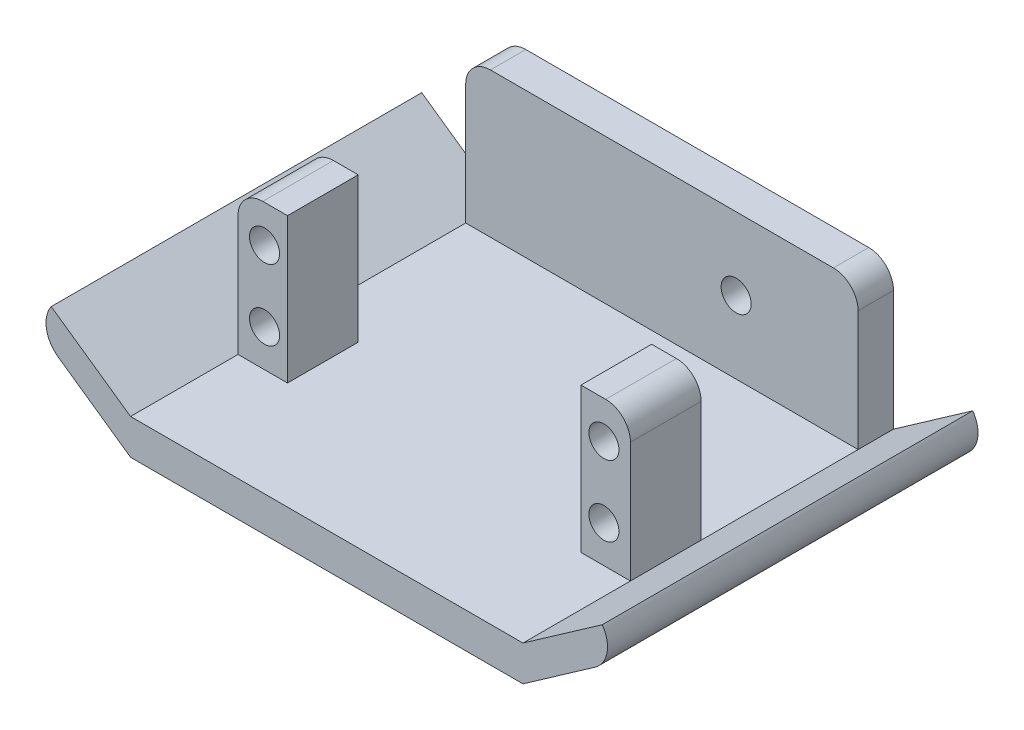
from build123d import *

# Parameters (mm, degrees)
SKETCH1_W           = 55.5
SKETCH1_H           = 40.4
BASE_DEPTH          = 5
SKETCH2_W           = 55.5
SKETCH2_H           = 25.5
WALL_DEPTH          = 5
SKETCH3_W           = 7
SKETCH3_H           = 20.5
MOUNTINGTABS_DEPTH  = 5
LIPS_REACH          = 75.23
SKETCH5_R           = 2.125
MOUNTINGHOLES_DEPTH = 5
FILLETS_R           = 3.5
SKETCH6_R           = 2.125
THROUGHHOLE_DEPTH   = 5
SKETCH7_R           = 2.125
BOSS_EXTRUDE1_DEPTH = 5
BOSS_EXTRUDE2_START = 12
BOSS_EXTRUDE2_DEPTH = 12


with BuildPart() as part:
    # Sketch1 → base (new body)
    with BuildSketch(Plane(origin=(0, 0, 0), x_dir=(1, 0, 0), z_dir=(0, 1, 0))):
        with Locations((27.75, 20.2)):
            Rectangle(SKETCH1_W, SKETCH1_H)
    extrude(amount=BASE_DEPTH)

    # Sketch2 → wall (add)
    with BuildSketch(Plane(origin=(0, 0, -40.4), x_dir=(-1, 0, 0), z_dir=(0, 0, -1))):
        with Locations((-27.75, 12.75)):
            Rectangle(SKETCH2_W, SKETCH2_H)
    extrude(amount=-WALL_DEPTH)

    # Sketch3 → mountingTabs (add)
    with BuildSketch(Plane.XY.offset(-8.2)):
        with Locations((3.5, 15.25)):
            Rectangle(SKETCH3_W, SKETCH3_H)
        with Locations((52, 15.25)):
            Rectangle(SKETCH3_W, SKETCH3_H)
    extrude(amount=MOUNTINGTABS_DEPTH)

    # lips: up to this face of the body (flat: up to its plane)
    lips_end = Plane(part.part.faces().sort_by_distance((27.75, 12.75, -40.4))[0])
    # Sketch4 → lips (add, up to the picked face)
    with BuildSketch(Plane.XY, mode=Mode.PRIVATE) as lips_sk1:
        with BuildLine():
            Line((0, 0), (-10.208884478, 7.148337868))
            ThreePointArc((-10.208884478, 7.148337868), (-11.894564223, 9.792816133), (-11.218174515, 12.85505036))
            Line((-11.218174515, 12.85505036), (0, 5))
            Line((0, 5), (0, 0))
        make_face()
    lips_tool1 = split(extrude(lips_sk1.sketch, amount=-LIPS_REACH, mode=Mode.PRIVATE), bisect_by=lips_end, keep=Keep.BOTH, mode=Mode.PRIVATE)
    # Sketch4 → lips (add, up to the picked face)
    with BuildSketch(Plane.XY, mode=Mode.PRIVATE) as lips_sk2:
        with BuildLine():
            Line((55.5, 5), (66.718174515, 12.85505036))
            ThreePointArc((66.718174515, 12.85505036), (67.394564223, 9.792816133), (65.708884478, 7.148337868))
            Line((65.708884478, 7.148337868), (55.5, 0))
            Line((55.5, 0), (55.5, 5))
        make_face()
    lips_tool2 = split(extrude(lips_sk2.sketch, amount=-LIPS_REACH, mode=Mode.PRIVATE), bisect_by=lips_end, keep=Keep.BOTH, mode=Mode.PRIVATE)
    add(lips_tool1.solids().sort_by(Axis((-5.839287, 6.590277, 0), (0, 0, -1)))[0])
    add(lips_tool2.solids().sort_by(Axis((61.339287, 6.590277, 0), (0, 0, -1)))[0])

    # Sketch5 → mountingHoles (cut)
    with BuildSketch(Plane.XY.offset(-3.2)):
        with Locations((3.75, 20.25)):
            Circle(SKETCH5_R)
        with Locations(Location((3.75, 10.25, 0), (0, 0, 180))):
            Circle(SKETCH5_R)
        with Locations((51.75, 10.25)):
            Circle(SKETCH5_R)
        with Locations(Location((51.75, 20.25, 0), (0, 0, 180))):
            Circle(SKETCH5_R)
    extrude(amount=-MOUNTINGHOLES_DEPTH, mode=Mode.SUBTRACT)

    # fillets
    fillets_edges = [part.edges().sort_by_distance(p)[0] for p in [
        (0, 25.5, -37.9),
        (55.5, 25.5, -37.9),
        (0, 25.5, -5.7),
        (55.5, 25.5, -5.7),
    ]]
    fillet(fillets_edges, radius=FILLETS_R)

    # Sketch6 → throughHole (cut)
    with BuildSketch(Plane.XY.offset(-35.4)):
        with Locations((38.25, 15.25)):
            Circle(SKETCH6_R)
    extrude(amount=-THROUGHHOLE_DEPTH, mode=Mode.SUBTRACT)

    # Sketch7 → Boss-Extrude1 (add)
    # profile 1 of 2: a face of its own
    with BuildSketch(Plane(origin=(0, 0, -8.2), x_dir=(-1, 0, 0), z_dir=(0, 0, -1))):
        with BuildLine():
            Line((-48.5, 25.5), (-52, 25.5))
            ThreePointArc((-52, 25.5), (-54.474873734, 24.474873734), (-55.5, 22))
            Line((-55.5, 22), (-55.5, 5))
            Line((-55.5, 5), (-48.5, 5))
            Line((-48.5, 5), (-48.5, 25.5))
        make_face()
        with Locations((-51.75, 20.25)):
            Circle(SKETCH7_R, mode=Mode.SUBTRACT)
        with Locations(Location((-51.75, 10.25, 0), (0, 0, 180))):
            Circle(SKETCH7_R, mode=Mode.SUBTRACT)
    # profile 2 of 2: a face of its own
    with BuildSketch(Plane(origin=(0, 0, -8.2), x_dir=(-1, 0, 0), z_dir=(0, 0, -1))):
        with BuildLine():
            Line((0, 5), (0, 22))
            ThreePointArc((0, 22), (-1.025126266, 24.474873734), (-3.5, 25.5))
            Line((-3.5, 25.5), (-7, 25.5))
            Line((-7, 25.5), (-7, 5))
            Line((-7, 5), (0, 5))
        make_face()
        with Locations((-3.75, 10.25)):
            Circle(SKETCH7_R, mode=Mode.SUBTRACT)
        with Locations(Location((-3.75, 20.25, 0), (0, 0, 180))):
            Circle(SKETCH7_R, mode=Mode.SUBTRACT)
    extrude(amount=BOSS_EXTRUDE1_DEPTH)

    # Sketch8 → Boss-Extrude2 (add)
    with BuildSketch(Plane.XY.offset(BOSS_EXTRUDE2_START)):
        with BuildLine():
            Line((0, 0), (55.5, 0))
            Line((55.5, 0), (65.708884478, 7.148337868))
            ThreePointArc((65.708884478, 7.148337868), (67.394564223, 9.792816133), (66.718174515, 12.85505036))
            Line((66.718174515, 12.85505036), (55.5, 5))
            Line((55.5, 5), (0, 5))
            Line((0, 5), (-11.218174515, 12.85505036))
            ThreePointArc((-11.218174515, 12.85505036), (-11.894564223, 9.792816133), (-10.208884478, 7.148337868))
            Line((-10.208884478, 7.148337868), (0, 0))
        make_face()
    extrude(amount=-BOSS_EXTRUDE2_DEPTH)


solid = part.part
